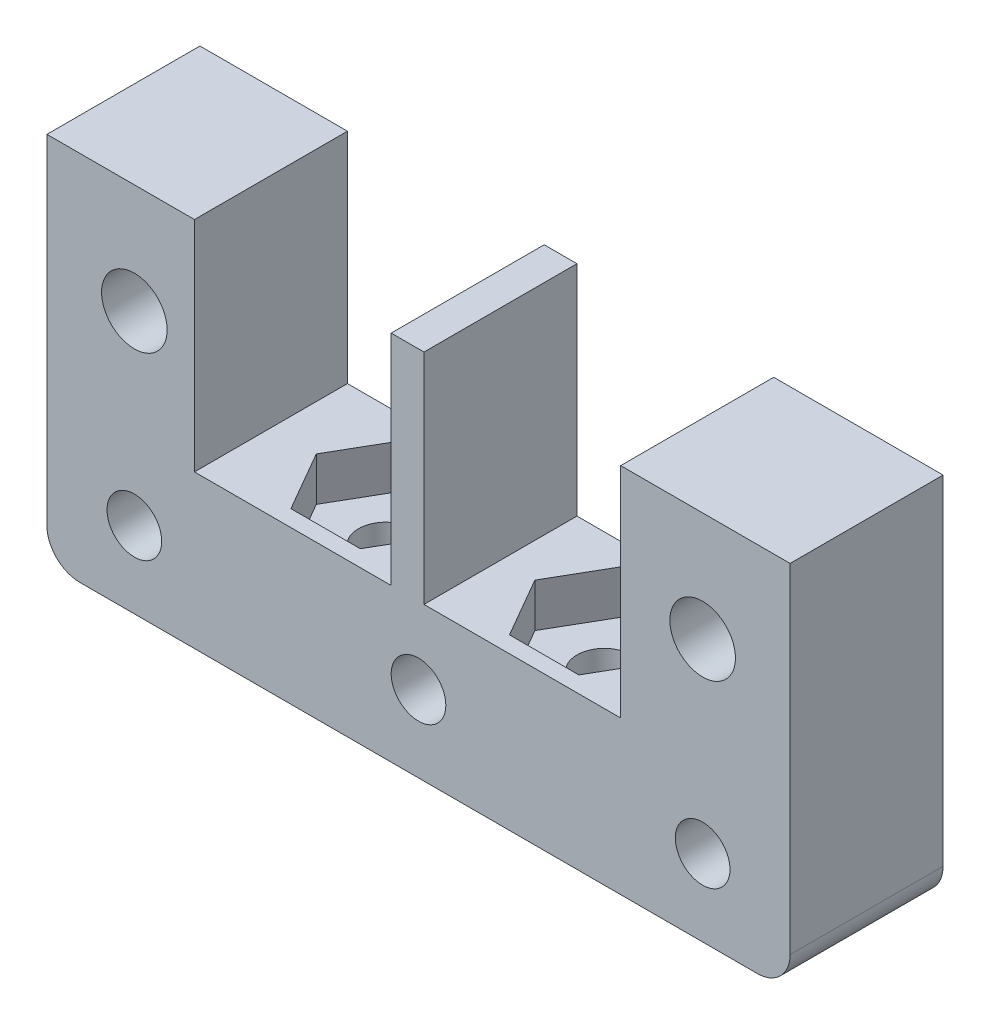
from build123d import *

# Parameters (mm, degrees)
SKETCH1_W           = 34
SKETCH1_H           = 7
SKETCH1_R           = 1.25
BOSS_EXTRUDE1_DEPTH = 7
SKETCH3_R           = 1.25
CUT_EXTRUDE1_DEPTH  = 10
SKETCH4_W           = 6.75
SKETCH4_H           = 7
SKETCH4_W_2         = 1.5
SKETCH4_W_3         = 7.75
BOSS_EXTRUDE2_DEPTH = 10
CUT_EXTRUDE2_DEPTH  = 2
FILLET4_R           = 1.5
SKETCH7_R           = 1.5
CUT_EXTRUDE4_DEPTH  = 10


with BuildPart() as part:
    # Sketch1 → Boss-Extrude1 (new body)
    with BuildSketch(Plane.XY):
        with Locations((17, 3.5)):
            Rectangle(SKETCH1_W, SKETCH1_H)
        with Locations((4, 3.5)):
            Circle(SKETCH1_R, mode=Mode.SUBTRACT)
        with Locations((30, 3.5)):
            Circle(SKETCH1_R, mode=Mode.SUBTRACT)
        with Locations((17, 3.5)):
            Circle(SKETCH1_R, mode=Mode.SUBTRACT)
    extrude(amount=BOSS_EXTRUDE1_DEPTH)

    # Sketch3 → Cut-Extrude1 (cut)
    with BuildSketch(Plane.XZ):
        with Locations(Location((22, 3.5, 0), (0, 0, 270))):
            Circle(SKETCH3_R)
        with Locations(Location((12, 3.5, 0), (0, 0, 270))):
            Circle(SKETCH3_R)
    extrude(amount=-CUT_EXTRUDE1_DEPTH, mode=Mode.SUBTRACT)

    # Sketch4 → Boss-Extrude2 (add)
    with BuildSketch(Plane(origin=(0, 7, 0), x_dir=(1, 0, 0), z_dir=(0, 1, 0))):
        with Locations((3.375, -3.5)):
            Rectangle(SKETCH4_W, SKETCH4_H)
        with Locations((16.5, -3.5)):
            Rectangle(SKETCH4_W_2, SKETCH4_H)
        with Locations((30.125, -3.5)):
            Rectangle(SKETCH4_W_3, SKETCH4_H)
    extrude(amount=BOSS_EXTRUDE2_DEPTH)

    # Sketch5 → Cut-Extrude2 (cut)
    with BuildSketch(Plane(origin=(0, 7, 0), x_dir=(1, 0, 0), z_dir=(0, 1, 0))):
        Polygon((15.175426481, -3.5), (13.58771324, -0.75), (10.41228676, -0.75), (8.824573519, -3.5), (10.41228676, -6.25), (13.58771324, -6.25), align=None)
        Polygon((25.175426481, -3.5), (23.58771324, -0.75), (20.41228676, -0.75), (18.824573519, -3.5), (20.41228676, -6.25), (23.58771324, -6.25), align=None)
    extrude(amount=-CUT_EXTRUDE2_DEPTH, mode=Mode.SUBTRACT)

    # Fillet4
    fillet4_edges = [part.edges().sort_by_distance(p)[0] for p in [
        (34, 0, 3.5),
        (0, 0, 3.5),
    ]]
    fillet(fillet4_edges, radius=FILLET4_R)

    # Sketch7 → Cut-Extrude4 (cut)
    with BuildSketch(Plane(origin=(0, 0, 0), x_dir=(-1, 0, 0), z_dir=(0, 0, -1))):
        with Locations((-30, 12)):
            Circle(SKETCH7_R)
        with Locations((-4, 12)):
            Circle(SKETCH7_R)
    extrude(amount=-CUT_EXTRUDE4_DEPTH, mode=Mode.SUBTRACT)


solid = part.part
